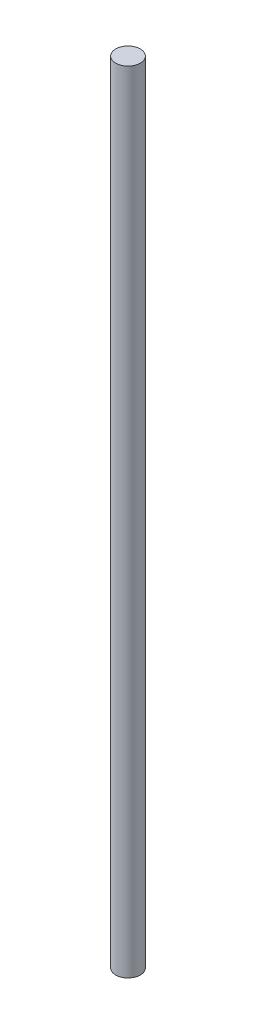
from build123d import *

# Parameters (mm, degrees)
SKETCH1_R           = 2.375
BOSS_EXTRUDE1_DEPTH = 152.4


with BuildPart() as part:
    # Sketch1 → Boss-Extrude1 (new body)
    with BuildSketch(Plane(origin=(0, 0, 0), x_dir=(1, 0, 0), z_dir=(0, 1, 0))):
        with Locations(Location((0, 0, 0), (0, 0, 90))):
            Circle(SKETCH1_R)
    extrude(amount=BOSS_EXTRUDE1_DEPTH)


solid = part.part
